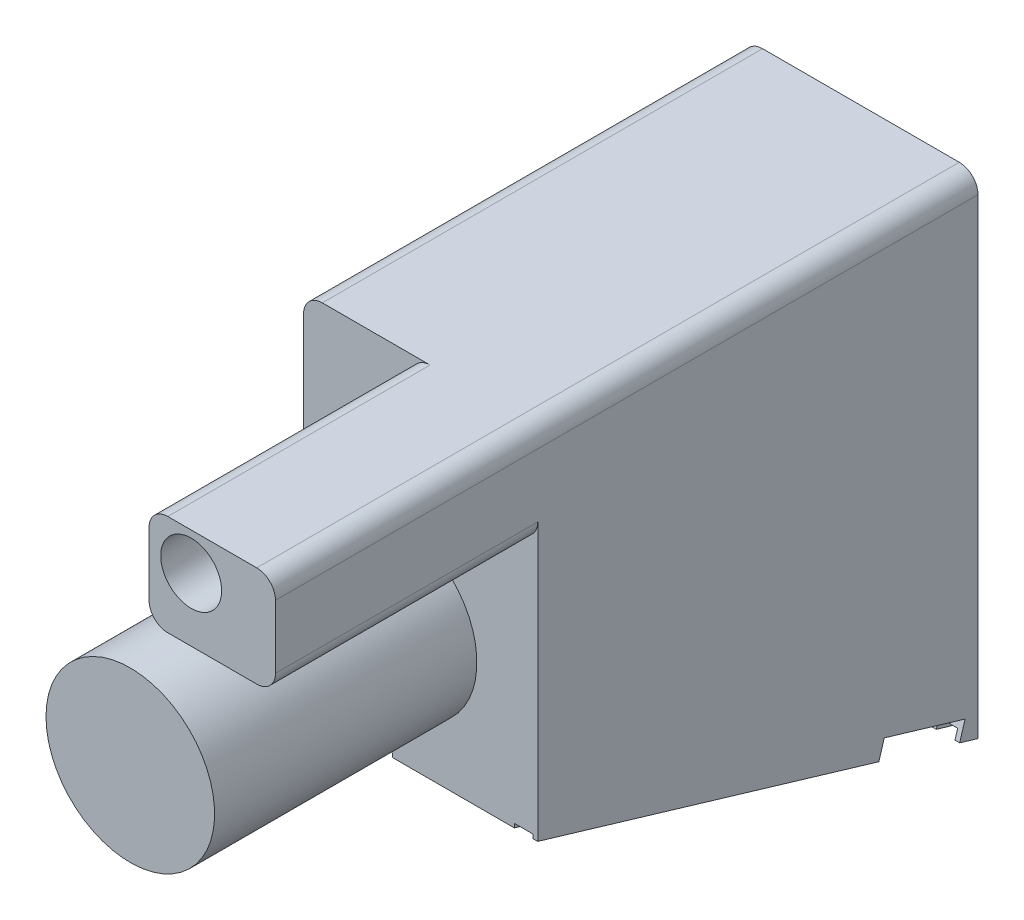
from build123d import *

# Parameters (mm, degrees)
SKETCH_1_W               = 25
SKETCH_1_H               = 60
EXTRUDE_1_DEPTH          = 75
SKETCH_3_R               = 9
CUT_EXTRUDE_1_DEPTH      = 58.142366069
SKETCH_4_R               = 3.25
CUT_EXTRUDE_2_DEPTH      = 62.320877358
SKETCH_5_R               = 1.5
CUT_EXTRUDE_3_DEPTH      = 62.320877358
SKETCH_6_W               = 25
SKETCH_6_H               = 5
CUT_EXTRUDE_4_DEPTH      = 82.738913621
CUT_EXTRUDE_5_DEPTH      = 85.557672626
SKETCH_9_R               = 3
CUT_EXTRUDE_6_DEPTH      = 85.994924721
SKETCH_10_W              = 10
SKETCH_10_H              = 10
CUT_EXTRUDE_7_DEPTH      = 5
CUT_EXTRUDE_8_DEPTH      = 15
CUT_EXTRUDE_8_DEPTH_BACK = 5
SKETCH_12_R              = 1
CUT_EXTRUDE_9_DEPTH      = 10
SKETCH_14_W              = 2
SKETCH_14_H              = 1
CUT_EXTRUDE_10_DEPTH     = 49.16
SKETCH_15_W              = 2.940527474
SKETCH_15_H              = 9
CUT_EXTRUDE_11_DEPTH     = 1
FILLET_1_R               = 2


with BuildPart() as part:
    # Эскиз1 → Бобышка-Вытянуть1 (new body)
    with BuildSketch(Plane.XY):
        Rectangle(SKETCH_1_W, SKETCH_1_H)
    extrude(amount=EXTRUDE_1_DEPTH)

    # Эскиз3 → Вырез-Вытянуть1 (cut, through all)
    with BuildSketch(Plane.XY.offset(47)):
        Polygon((-12.5, -30), (12.5, -30), (12.5, 14.25), (-1, 14.25), (-1, 30), (-12.5, 30), align=None)
        with Locations(Location((-3, 0, 0), (0, 0, 180))):
            Circle(SKETCH_3_R, mode=Mode.SUBTRACT)
    extrude(amount=CUT_EXTRUDE_1_DEPTH, mode=Mode.SUBTRACT)

    # Эскиз4 → Вырез-Вытянуть2 (cut, through all)
    with BuildSketch(Plane.XY.offset(52)):
        with Locations((3.5, 21)):
            Circle(SKETCH_4_R)
    extrude(amount=CUT_EXTRUDE_2_DEPTH, mode=Mode.SUBTRACT)

    # Эскиз5 → Вырез-Вытянуть3 (cut, through all)
    with BuildSketch(Plane.XY.offset(52)):
        with Locations((3.5, 21)):
            Circle(SKETCH_5_R)
    extrude(amount=-CUT_EXTRUDE_3_DEPTH, mode=Mode.SUBTRACT)

    # Эскиз6 → Вырез-Вытянуть4 (cut, through all)
    with BuildSketch(Plane(origin=(0, 0, 0), x_dir=(-1, 0, 0), z_dir=(0, 0, -1))):
        with Locations((0, 27.5)):
            Rectangle(SKETCH_6_W, SKETCH_6_H)
    extrude(amount=-CUT_EXTRUDE_4_DEPTH, mode=Mode.SUBTRACT)

    # Эскиз8 → Вырез-Вытянуть5 (cut, through all)
    with BuildSketch(Plane(origin=(12.5, 0, 0), x_dir=(0, 0, -1), z_dir=(1, 0, 0))):
        Polygon((-6.266839037, -25.421365839), (-47, -13.294552658), (-47, -30), (0, -30), (0, -27.287088617), align=None)
    extrude(amount=-CUT_EXTRUDE_5_DEPTH, mode=Mode.SUBTRACT)

    # Эскиз9 → Вырез-Вытянуть6 (cut, through all)
    with BuildSketch(Plane(origin=(0, -25.065453583, 7.462324694), x_dir=(1, 0, 0), z_dir=(0, -0.9584273167859609, 0.2853367807319331))):
        with Locations(Location((3.5, -1.247340968, 0), (0, 0, 270))):
            Circle(SKETCH_9_R)
    extrude(amount=-CUT_EXTRUDE_6_DEPTH, mode=Mode.SUBTRACT)

    # Эскиз10 → Вырез-Вытянуть7 (cut)
    with BuildSketch(Plane(origin=(0, -25.065453583, 7.462324694), x_dir=(1, 0, 0), z_dir=(0, -0.9584273167859609, 0.2853367807319331))):
        with Locations((3.5, -1.247340968)):
            Rectangle(SKETCH_10_W, SKETCH_10_H)
    extrude(amount=-CUT_EXTRUDE_7_DEPTH, mode=Mode.SUBTRACT)

    # Эскиз11 → Вырез-Вытянуть8 (cut, two sides: drawn at the far end of the back side and taken through both)
    with BuildSketch(Plane(origin=(-1.5, 0, 0), x_dir=(0, 0, -1), z_dir=(1, 0, 0)).offset(-CUT_EXTRUDE_8_DEPTH_BACK)):
        Polygon((-10.579761962, -24.137350326), (-1.953916111, -26.705381353), (-1.38324255, -24.788526719), (-10.009088401, -22.220495692), align=None)
    extrude(amount=CUT_EXTRUDE_8_DEPTH + CUT_EXTRUDE_8_DEPTH_BACK, mode=Mode.SUBTRACT)

    # Эскиз12 → Вырез-Вытянуть9 (cut)
    with BuildSketch(Plane(origin=(0, -25.065453583, 7.462324694), x_dir=(1, 0, 0), z_dir=(0, -0.9584273167859609, 0.2853367807319331))):
        with Locations(Location((-4, 39.752659032, 0), (0, 0, 270))):
            Circle(SKETCH_12_R)
        with Locations(Location((11, 39.752659032, 0), (0, 0, 90))):
            Circle(SKETCH_12_R)
    extrude(amount=-CUT_EXTRUDE_9_DEPTH, mode=Mode.SUBTRACT)

    # Эскиз14 → Вырез-Вытянуть10 (cut)
    with BuildSketch(Plane(origin=(0, -55.116213781, 8.285107119), x_dir=(-1, 0, 0), z_dir=(0, 0.285336780731933, 0.9584273167859609))):
        with Locations((4, -29.536239553)):
            Rectangle(SKETCH_14_W, SKETCH_14_H)
        with Locations((-11, -29.536239553)):
            Rectangle(SKETCH_14_W, SKETCH_14_H)
    extrude(amount=CUT_EXTRUDE_10_DEPTH, mode=Mode.SUBTRACT)

    # Эскиз15 → Вырез-Вытянуть11 (cut)
    with BuildSketch(Plane(origin=(0, -25.065453583, 7.462324694), x_dir=(1, 0, 0), z_dir=(0, -0.9584273167859609, 0.2853367807319331))):
        with Locations((0.529736263, 29.252659032)):
            Rectangle(SKETCH_15_W, SKETCH_15_H)
    extrude(amount=-CUT_EXTRUDE_11_DEPTH, mode=Mode.SUBTRACT)

    # Скругление1
    fillet_1_edges = [part.edges().sort_by_distance(p)[0] for p in [
        (12.5, 14.25, 61),
        (-1, 14.25, 61),
        (-1, 25, 61),
        (-12.5, 25, 23.5),
        (12.5, 25, 37.5),
    ]]
    fillet(fillet_1_edges, radius=FILLET_1_R)


solid = part.part
